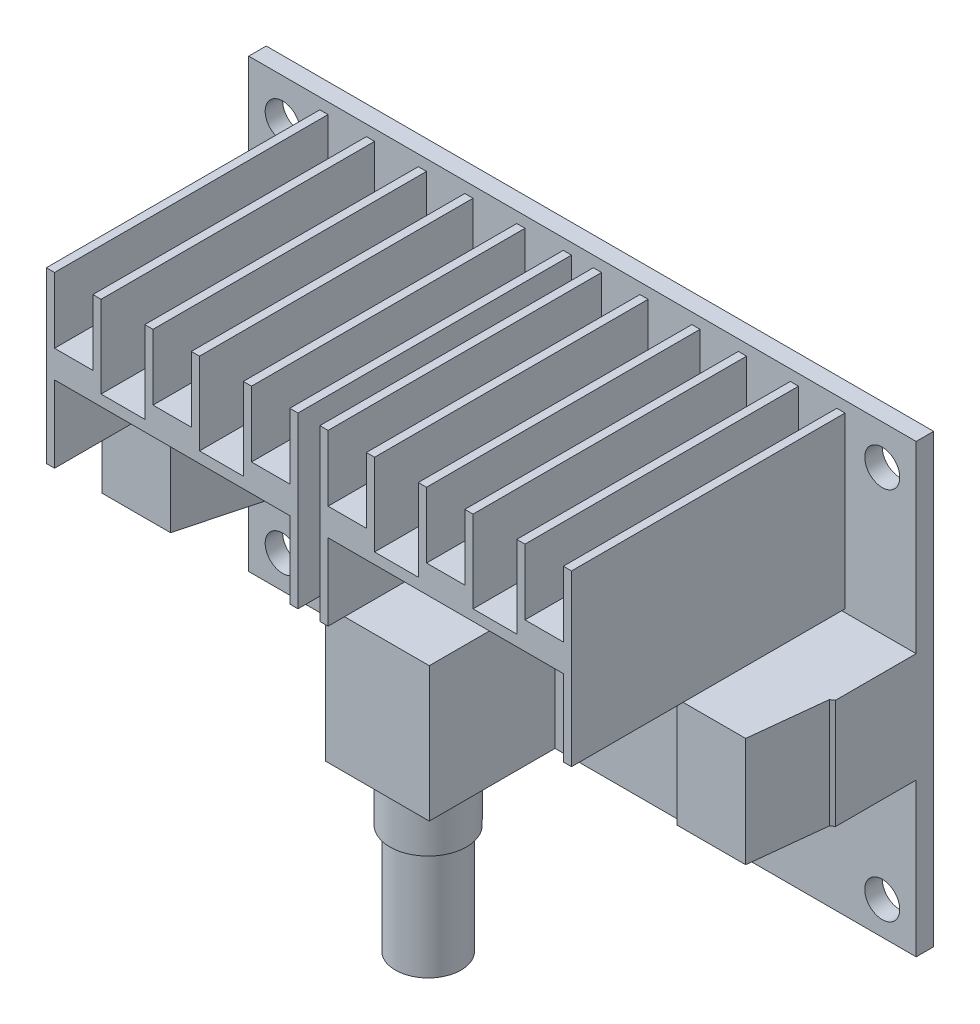
from build123d import *

# Parameters (mm, degrees)
SKETCH2_W           = 61
SKETCH2_H           = 40.8
SKETCH2_R           = 1.6
BOSS_EXTRUDE1_DEPTH = 1.6
BOSS_EXTRUDE2_DEPTH = 25
SKETCH5_W           = 9.5
SKETCH5_H           = 12.3
BOSS_EXTRUDE3_DEPTH = 11.5
SKETCH6_R           = 3.5
BOSS_EXTRUDE4_DEPTH = 5
SKETCH7_R           = 3
BOSS_EXTRUDE5_DEPTH = 10
SKETCH8_W           = 10
SKETCH8_H           = 10
BOSS_EXTRUDE6_DEPTH = 14.5
CUT_EXTRUDE1_DEPTH  = 10


with BuildPart() as part:
    # Sketch2 → Boss-Extrude1 (new body)
    with BuildSketch(Plane.XY):
        Rectangle(SKETCH2_W, SKETCH2_H)
        with Locations((-27.4, 16.8)):
            Circle(SKETCH2_R, mode=Mode.SUBTRACT)
        with Locations((27.4, 16.8)):
            Circle(SKETCH2_R, mode=Mode.SUBTRACT)
        with Locations((-27.4, -17.4)):
            Circle(SKETCH2_R, mode=Mode.SUBTRACT)
        with Locations((27.4, -17.4)):
            Circle(SKETCH2_R, mode=Mode.SUBTRACT)
    extrude(amount=BOSS_EXTRUDE1_DEPTH)

    # Sketch3 → Boss-Extrude2 (add)
    with BuildSketch(Plane.XY.offset(1.6)):
        Polygon((-24, 19.4), (-24, 3.9), (-23.25, 3.9), (-23.25, 10.9), (-1.75, 10.9), (-1.75, 3.9), (-1, 3.9), (-1, 19.4), (-1.75, 19.4), (-1.75, 13.4), (-5.25, 13.4), (-5.25, 19.4), (-6, 19.4), (-6, 11.9), (-10, 11.9), (-10, 19.4), (-10.75, 19.4), (-10.75, 13.4), (-14.25, 13.4), (-14.25, 19.4), (-15, 19.4), (-15, 11.9), (-19, 11.9), (-19, 19.4), (-19.75, 19.4), (-19.75, 13.4), (-23.25, 13.4), (-23.25, 19.4), align=None)
        Polygon((14.25, 19.4), (14.25, 13.4), (10.75, 13.4), (10.75, 19.4), (10, 19.4), (10, 11.9), (6, 11.9), (6, 19.4), (5.25, 19.4), (5.25, 13.4), (1.75, 13.4), (1.75, 19.4), (1, 19.4), (1, 3.9), (1.75, 3.9), (1.75, 10.9), (23.25, 10.9), (23.25, 3.9), (24, 3.9), (24, 19.4), (23.25, 19.4), (23.25, 13.4), (19.75, 13.4), (19.75, 19.4), (19, 19.4), (19, 11.9), (15, 11.9), (15, 19.4), align=None)
    extrude(amount=BOSS_EXTRUDE2_DEPTH)

    # Sketch5 → Boss-Extrude3 (add)
    with BuildSketch(Plane.XY.offset(1.6)):
        with Locations((-7.25, -14.25)):
            Rectangle(SKETCH5_W, SKETCH5_H)
    extrude(amount=BOSS_EXTRUDE3_DEPTH)

    # Sketch6 → Boss-Extrude4 (add)
    with BuildSketch(Plane.XZ.offset(20.4)):
        with Locations(Location((-7.25, 8.45, 0), (0, 0, 90))):
            Circle(SKETCH6_R)
    extrude(amount=BOSS_EXTRUDE4_DEPTH)

    # Sketch7 → Boss-Extrude5 (add)
    with BuildSketch(Plane.XZ.offset(25.4)):
        with Locations(Location((-7.25, 8.45, 0), (0, 0, 270))):
            Circle(SKETCH7_R)
    extrude(amount=BOSS_EXTRUDE5_DEPTH)

    # Sketch8 → Boss-Extrude6 (add)
    with BuildSketch(Plane.XY.offset(1.6)):
        with Locations((-25.5, -1.4)):
            Rectangle(SKETCH8_W, SKETCH8_H)
        with Locations((25.5, -1.4)):
            Rectangle(SKETCH8_W, SKETCH8_H)
    extrude(amount=BOSS_EXTRUDE6_DEPTH)

    # Sketch9 → Cut-Extrude1 (cut)
    with BuildSketch(Plane.XZ.offset(6.4)):
        Polygon((-23.151020569, 16.1), (-20.5, 6.14534258), (-16.249696832, 6.089417538), (-15.914146582, 20.014752918), (-23.095095527, 19.846977793), align=None)
        Polygon((-29.415736124, 16.1), (-30.16614877, 9.208365841), (-30.5, 8.949622517), (-32.813418931, 7.814737758), (-35.128393598, 16.673480385), (-30.436281354, 21.104919727), align=None)
        Polygon((30.436281354, 21.104919727), (29.415736124, 16.1), (30.16614877, 9.208365841), (30.5, 8.949622517), (32.813418931, 7.814737758), (35.128393598, 16.673480385), align=None)
        Polygon((23.095095527, 19.846977793), (23.151020569, 16.1), (20.5, 6.14534258), (16.249696832, 6.089417538), (15.914146582, 20.014752918), align=None)
    extrude(amount=-CUT_EXTRUDE1_DEPTH, mode=Mode.SUBTRACT)


solid = part.part
